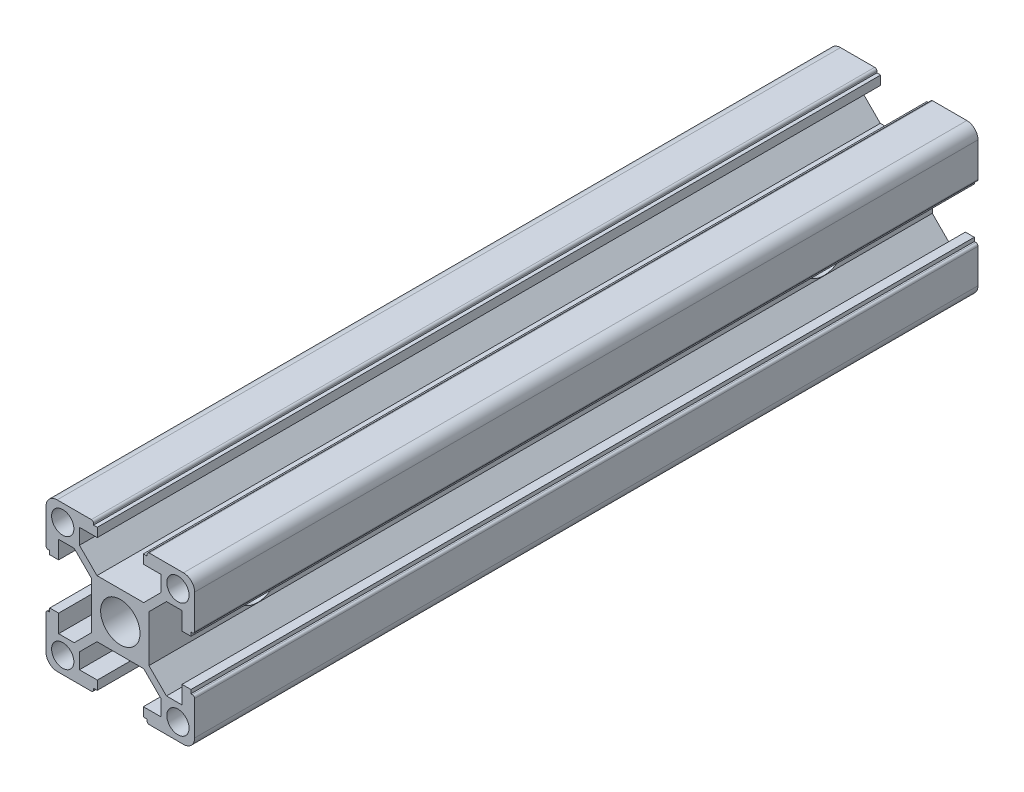
from build123d import *

# Parameters (mm, degrees)
SKETCH_1_R          = 2.65
SKETCH_1_R_2        = 1.5
EXTRUDE_1_DEPTH     = 52.7
SKETCH_4_R          = 3.1
CUT_EXTRUDE_3_DEPTH = 56.399571298


with BuildPart() as part:
    # 草图1 → 凸台-拉伸1 (new, symmetric)
    with BuildSketch(Plane.XY):
        with BuildLine():
            Line((3.142893219, 3.85), (-3.142893219, 3.85))
            Line((-3.142893219, 3.85), (-5.5, 6.207106781))
            Line((-5.5, 6.207106781), (-5.5, 8.3))
            Line((-5.5, 8.3), (-3.1, 8.3))
            Line((-3.1, 8.3), (-3.1, 9.5))
            Line((-3.1, 9.5), (-3.6, 9.5))
            Line((-3.6, 9.5), (-3.6, 9.7))
            ThreePointArc((-3.6, 9.7), (-3.687867966, 9.912132034), (-3.9, 10))
            Line((-3.9, 10), (-8.5, 10))
            ThreePointArc((-8.5, 10), (-9.560660172, 9.560660172), (-10, 8.5))
            Line((-10, 8.5), (-10, 3.9))
            ThreePointArc((-10, 3.9), (-9.912132034, 3.687867966), (-9.7, 3.6))
            Line((-9.7, 3.6), (-9.5, 3.6))
            Line((-9.5, 3.6), (-9.5, 3.1))
            Line((-9.5, 3.1), (-8.3, 3.1))
            Line((-8.3, 3.1), (-8.3, 5.5))
            Line((-8.3, 5.5), (-6.207106781, 5.5))
            Line((-6.207106781, 5.5), (-3.85, 3.142893219))
            Line((-3.85, 3.142893219), (-3.85, -3.142893219))
            Line((-3.85, -3.142893219), (-6.207106781, -5.5))
            Line((-6.207106781, -5.5), (-8.3, -5.5))
            Line((-8.3, -5.5), (-8.3, -3.1))
            Line((-8.3, -3.1), (-9.5, -3.1))
            Line((-9.5, -3.1), (-9.5, -3.6))
            Line((-9.5, -3.6), (-9.7, -3.6))
            ThreePointArc((-9.7, -3.6), (-9.912132034, -3.687867966), (-10, -3.9))
            Line((-10, -3.9), (-10, -8.5))
            ThreePointArc((-10, -8.5), (-9.560660172, -9.560660172), (-8.5, -10))
            Line((-8.5, -10), (-3.9, -10))
            ThreePointArc((-3.9, -10), (-3.687867966, -9.912132034), (-3.6, -9.7))
            Line((-3.6, -9.7), (-3.6, -9.5))
            Line((-3.6, -9.5), (-3.1, -9.5))
            Line((-3.1, -9.5), (-3.1, -8.3))
            Line((-3.1, -8.3), (-5.5, -8.3))
            Line((-5.5, -8.3), (-5.5, -6.207106781))
            Line((-5.5, -6.207106781), (-3.142893219, -3.85))
            Line((-3.142893219, -3.85), (3.142893219, -3.85))
            Line((3.142893219, -3.85), (5.5, -6.207106781))
            Line((5.5, -6.207106781), (5.5, -8.3))
            Line((5.5, -8.3), (3.1, -8.3))
            Line((3.1, -8.3), (3.1, -9.5))
            Line((3.1, -9.5), (3.6, -9.5))
            Line((3.6, -9.5), (3.6, -9.7))
            ThreePointArc((3.6, -9.7), (3.687867966, -9.912132034), (3.9, -10))
            Line((3.9, -10), (8.5, -10))
            ThreePointArc((8.5, -10), (9.560660172, -9.560660172), (10, -8.5))
            Line((10, -8.5), (10, -3.9))
            ThreePointArc((10, -3.9), (9.912132034, -3.687867966), (9.7, -3.6))
            Line((9.7, -3.6), (9.5, -3.6))
            Line((9.5, -3.6), (9.5, -3.1))
            Line((9.5, -3.1), (8.3, -3.1))
            Line((8.3, -3.1), (8.3, -5.5))
            Line((8.3, -5.5), (6.207106781, -5.5))
            Line((6.207106781, -5.5), (3.85, -3.142893219))
            Line((3.85, -3.142893219), (3.85, 3.142893219))
            Line((3.85, 3.142893219), (6.207106781, 5.5))
            Line((6.207106781, 5.5), (8.3, 5.5))
            Line((8.3, 5.5), (8.3, 3.1))
            Line((8.3, 3.1), (9.5, 3.1))
            Line((9.5, 3.1), (9.5, 3.6))
            Line((9.5, 3.6), (9.7, 3.6))
            ThreePointArc((9.7, 3.6), (9.912132034, 3.687867966), (10, 3.9))
            Line((10, 3.9), (10, 8.5))
            ThreePointArc((10, 8.5), (9.560660172, 9.560660172), (8.5, 10))
            Line((8.5, 10), (3.9, 10))
            ThreePointArc((3.9, 10), (3.687867966, 9.912132034), (3.6, 9.7))
            Line((3.6, 9.7), (3.6, 9.5))
            Line((3.6, 9.5), (3.1, 9.5))
            Line((3.1, 9.5), (3.1, 8.3))
            Line((3.1, 8.3), (5.5, 8.3))
            Line((5.5, 8.3), (5.5, 6.207106781))
            Line((5.5, 6.207106781), (3.142893219, 3.85))
        make_face()
        with Locations(Location((0, 0, 0), (0, 0, 180))):
            Circle(SKETCH_1_R, mode=Mode.SUBTRACT)
        with Locations(Location((-7.75, 7.75, 0), (0, 0, 180))):
            Circle(SKETCH_1_R_2, mode=Mode.SUBTRACT)
        with Locations(Location((7.75, 7.75, 0), (0, 0, 180))):
            Circle(SKETCH_1_R_2, mode=Mode.SUBTRACT)
        with Locations(Location((7.75, -7.75, 0), (0, 0, 180))):
            Circle(SKETCH_1_R_2, mode=Mode.SUBTRACT)
        with Locations(Location((-7.75, -7.75, 0), (0, 0, 180))):
            Circle(SKETCH_1_R_2, mode=Mode.SUBTRACT)
    extrude(amount=EXTRUDE_1_DEPTH, both=True)

    # 草图4 → 切除-拉伸3 (cut, through all)
    with BuildSketch(Plane(origin=(3.85, 0, 0), x_dir=(0, 0, -1), z_dir=(1, 0, 0))):
        with Locations((-38.1, 0)):
            Circle(SKETCH_4_R)
        with Locations((38.1, 0)):
            Circle(SKETCH_4_R)
    extrude(amount=-CUT_EXTRUDE_3_DEPTH, mode=Mode.SUBTRACT)


solid = part.part
